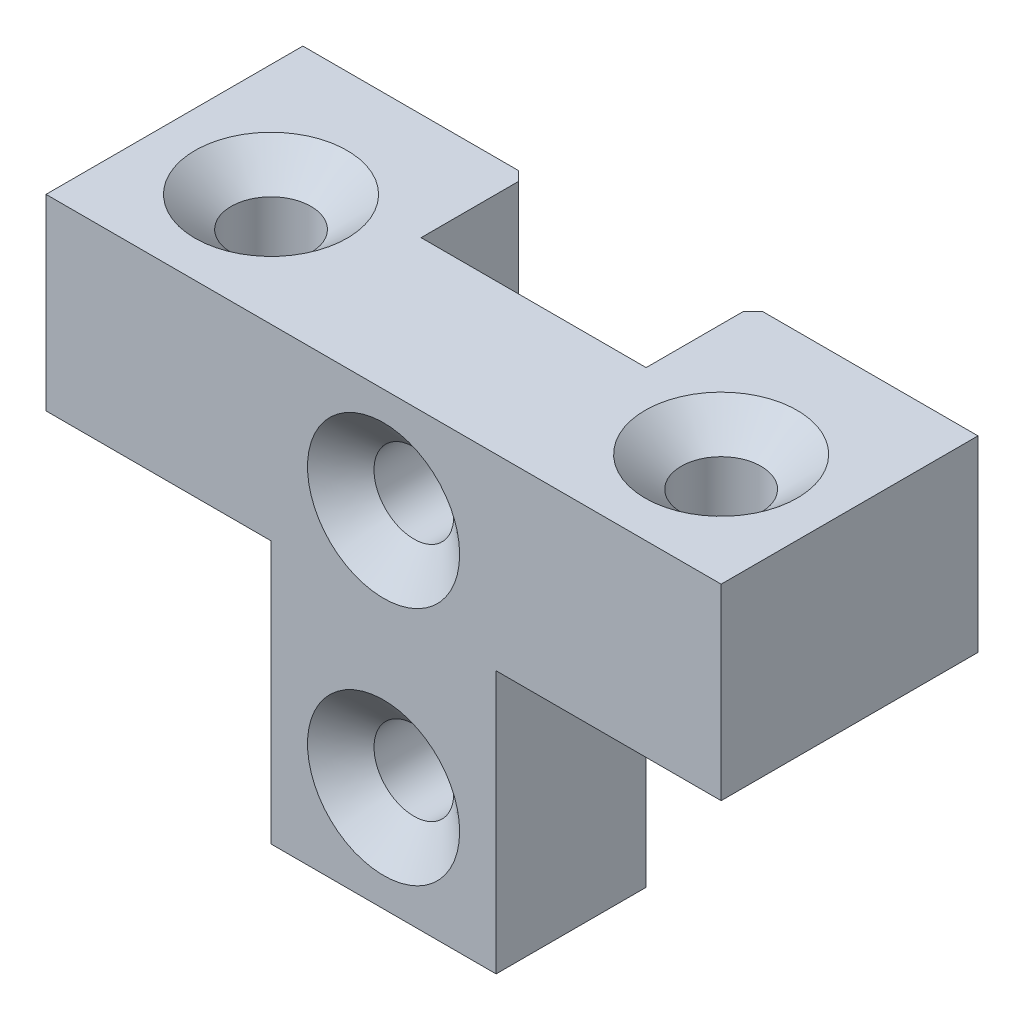
from build123d import *

# Parameters (mm, degrees)
BOSS_EXTRUDE1_DEPTH                                 = 12.7
CSK_FOR_1_4_FLAT_HEAD_MACHINE_SCREW_100_D           = 6.7564
CSK_FOR_1_4_FLAT_HEAD_MACHINE_SCREW_100_CSINK_D     = 12.8778
CSK_FOR_1_4_FLAT_HEAD_MACHINE_SCREW_100_CSINK_ANGLE = 100
SKETCH6_W                                           = 19.05
SKETCH6_H                                           = 15.875
BOSS_EXTRUDE2_DEPTH                                 = 9.0424
CSK_FOR_1_4_FLAT_HEAD_MACHINE_SCREW_2_D             = 6.7564
CSK_FOR_1_4_FLAT_HEAD_MACHINE_SCREW_2_CSINK_D       = 12.8778
CSK_FOR_1_4_FLAT_HEAD_MACHINE_SCREW_2_CSINK_ANGLE   = 100
CHAMFER1_SIZE                                       = 0.79375


with BuildPart() as part:
    # Sketch1 → Boss-Extrude1 (new body)
    with BuildSketch(Plane.XY):
        Polygon((-28.575, 19.05), (28.575, 19.05), (28.575, 3.175), (19.05, 3.175), (9.525, 3.175), (9.525, -19.05), (-9.525, -19.05), (-9.525, 3.175), (-19.05, 3.175), (-28.575, 3.175), align=None)
    extrude(amount=-BOSS_EXTRUDE1_DEPTH)

    # CSK for 1_4 Flat Head Machine Screw _100 (through all)
    with Locations(Plane.XY):
        with Locations((0, 10.16), (0, -10.16)):
            CounterSinkHole(CSK_FOR_1_4_FLAT_HEAD_MACHINE_SCREW_100_D / 2, CSK_FOR_1_4_FLAT_HEAD_MACHINE_SCREW_100_CSINK_D / 2, counter_sink_angle=CSK_FOR_1_4_FLAT_HEAD_MACHINE_SCREW_100_CSINK_ANGLE)

    # Sketch6 → Boss-Extrude2 (add)
    with BuildSketch(Plane.XY.offset(-12.7)):
        with Locations((-19.05, 11.1125)):
            Rectangle(SKETCH6_W, SKETCH6_H)
        with Locations((19.05, 11.1125)):
            Rectangle(SKETCH6_W, SKETCH6_H)
    extrude(amount=-BOSS_EXTRUDE2_DEPTH)

    # CSK for 1_4 Flat Head Machine Screw  2 (through all)
    with Locations(Plane(origin=(0, 19.05, 0), x_dir=(1, 0, 0), z_dir=(0, 1, 0))):
        with Locations((-19.05, 9.525), (19.05, 9.525)):
            CounterSinkHole(CSK_FOR_1_4_FLAT_HEAD_MACHINE_SCREW_2_D / 2, CSK_FOR_1_4_FLAT_HEAD_MACHINE_SCREW_2_CSINK_D / 2, counter_sink_angle=CSK_FOR_1_4_FLAT_HEAD_MACHINE_SCREW_2_CSINK_ANGLE)

    # Chamfer1
    chamfer1_edges = [part.edges().sort_by_distance(p)[0] for p in [
        (-9.525, 11.1125, -21.7424),
        (9.525, 11.1125, -21.7424),
    ]]
    chamfer(chamfer1_edges, length=CHAMFER1_SIZE)


solid = part.part
